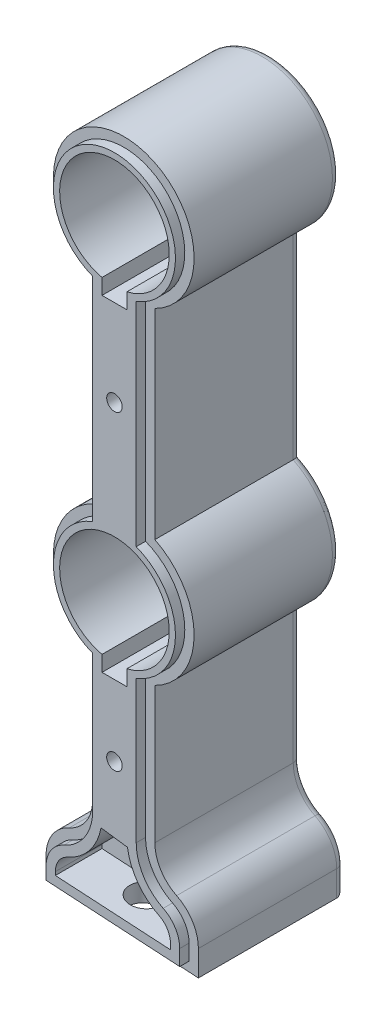
from build123d import *

# Parameters (mm, degrees)
SKETCH_15_R          = 9.05
SKETCH_15_R_2        = 6.25
EXTRUDE_4_DEPTH      = 20
EXTRUDE_4_2_DEPTH    = 20
SKETCH_16_W          = 8
SKETCH_16_H          = 25.763929046
EXTRUDE_4_3_DEPTH    = 20
EXTRUDE_5_DEPTH      = 20
FILLET_5_R           = 5
FILLET_6_R           = 5
FILLET_7_R           = 1
CUT_EXTRUDE_START    = -18.8
SKETCH_18_R          = 7.05
SKETCH_18_R_2        = 6.25
CUT_EXTRUDE_2_DEPTH  = 18.8
CUT_EXTRUDE_START_2  = -1.2
CUT_EXTRUDE_3_DEPTH  = 1.2
SKETCH_20_R          = 1
CUT_EXTRUDE_6_DEPTH  = 8
SKETCH_21_R          = 2.5
SKETCH_21_R_2        = 2
CUT_EXTRUDE_7_DEPTH  = 4
SKETCH_22_R          = 1.6
SKETCH_22_R_2        = 2
CUT_EXTRUDE_8_DEPTH  = 4
EXTRUDE_5_2_DEPTH    = 1
CUT_EXTRUDE_START_3  = -6
CUT_EXTRUDE_9_DEPTH  = 6
CUT_EXTRUDE_START_4  = -1
CUT_EXTRUDE_10_DEPTH = 1
SKETCH_26_W          = 3.2
SKETCH_26_H          = 2
CUT_EXTRUDE_11_DEPTH = 18.8


with BuildPart() as part:
    # Эскиз15 → Extrude 4 (new body)
    with BuildSketch(Plane.XY):
        with Locations((0, 21)):
            Circle(SKETCH_15_R)
        with Locations((0, 21)):
            Circle(SKETCH_15_R_2, mode=Mode.SUBTRACT)
    extrude(amount=EXTRUDE_4_DEPTH)



with BuildPart() as body_2:
    # Эскиз15 → Extrude 4 2 (new body)
    with BuildSketch(Plane.XY):
        with Locations((0, -21)):
            Circle(SKETCH_15_R)
        with Locations((0, -21)):
            Circle(SKETCH_15_R_2, mode=Mode.SUBTRACT)
    extrude(amount=EXTRUDE_4_2_DEPTH)


with BuildPart() as part_1:
    add(part.part)

    add(body_2.part)  # Extrude 4 3 merges body 2
    # Эскиз16 → Extrude 4 3 (add)
    with BuildSketch(Plane.XY.offset(20)):
        Polygon((-4, -29.118035477), (-4, -58.118035477), (4, -58.590520728), (4, -29.118035477), align=None)
        Rectangle(SKETCH_16_W, SKETCH_16_H)
    extrude(amount=-EXTRUDE_4_3_DEPTH)

    # Эскиз17 → Extrude 5 (add)
    with BuildSketch(Plane(origin=(0, 0, 0), x_dir=(-1, 0, 0), z_dir=(0, 0, -1))):
        Polygon((4, -58.118035477), (10, -57.763671538), (10, -49.763671538), (-9.6, -50.921260403), (-9.6, -58.921260403), (-4, -58.590520728), align=None)
    extrude(amount=-EXTRUDE_5_DEPTH)

    # Скругление5
    fillet_5_edges = [part_1.edges().sort_by_distance(p)[0] for p in [
        (9.6, -50.921260403, 10),
        (-10, -49.763671538, 10),
    ]]
    fillet(fillet_5_edges, radius=FILLET_5_R)

    # Скругление6
    fillet_6_edges = [part_1.edges().sort_by_distance(p)[0] for p in [
        (-4, -50.118035477, 10),
        (4, -50.590520728, 10),
    ]]
    fillet(fillet_6_edges, radius=FILLET_6_R)

    # Скругление7
    fillet_7_edges = [part_1.edges().sort_by_distance(p)[0] for p in [
        (8.842640687, -52.988918622, 0),
        (4, -37.886363841, 0),
        (-4.816699867, -48.641149029, 0),
        (4.757359313, -49.300443516, 0),
        (0, 30.05, 0),
        (-4, 0, 0),
        (4, 0, 0),
        (-6.25, -21, 0),
        (-9.05, -21, 0),
        (9.05, -21, 0),
        (-0.2, -58.342465971, 0),
        (-4, -37.510285859, 0),
        (-6.25, 21, 0),
        (-10, -56.415679585, 0),
        (9.6, -57.277965168, 0),
        (-9.183300133, -52.329074844, 0),
    ]]
    fillet(fillet_7_edges, radius=FILLET_7_R)

    # Эскиз18 → Вырез-Вытянуть-Тонкостенный2 (cut)
    # profile 1 of 2: a face of its own
    with BuildSketch(Plane.XY.offset(20).offset(CUT_EXTRUDE_START)):
        with Locations((0, -21)):
            Circle(SKETCH_18_R)
        with Locations((0, -21)):
            Circle(SKETCH_18_R_2, mode=Mode.SUBTRACT)
    # profile 2 of 2: a face of its own
    with BuildSketch(Plane.XY.offset(20).offset(CUT_EXTRUDE_START)):
        with Locations((0, 21)):
            Circle(SKETCH_18_R)
        with Locations((0, 21)):
            Circle(SKETCH_18_R_2, mode=Mode.SUBTRACT)
    extrude(amount=CUT_EXTRUDE_2_DEPTH, mode=Mode.SUBTRACT)

    # Эскиз19 → Вырез-Вытянуть-Тонкостенный3 (cut)
    with BuildSketch(Plane.XY.offset(20).offset(CUT_EXTRUDE_START_2)):
        with BuildLine():
            Line((-10, -55.067687632), (-10, -57.763671538))
            Line((-10, -57.763671538), (9.6, -58.921260403))
            Line((9.6, -58.921260403), (9.6, -55.634669933))
            ThreePointArc((9.6, -55.634669933), (8.842640687, -52.988918622), (6.8, -51.144681069))
            ThreePointArc((6.8, -51.144681069), (4.757359313, -49.300443516), (4, -46.654692205))
            Line((4, -46.654692205), (4, -29.118035477))
            ThreePointArc((4, -29.118035477), (9.05, -21), (4, -12.881964523))
            Line((4, -12.881964523), (4, 12.881964523))
            ThreePointArc((4, 12.881964523), (0, 30.05), (-4, 12.881964523))
            Line((-4, 12.881964523), (-4, -12.881964523))
            ThreePointArc((-4, -12.881964523), (-9.05, -21), (-4, -29.118035477))
            Line((-4, -29.118035477), (-4, -45.902536242))
            ThreePointArc((-4, -45.902536242), (-4.816699867, -48.641149029), (-7, -50.485111937))
            ThreePointArc((-7, -50.485111937), (-9.183300133, -52.329074844), (-10, -55.067687632))
        make_face()
        with BuildLine():
            Line((-8.8, -55.067687632), (-8.8, -56.632453251))
            Line((-8.8, -56.632453251), (8.4, -57.648296541))
            Line((8.4, -57.648296541), (8.4, -55.634669933))
            ThreePointArc((8.4, -55.634669933), (7.824406922, -53.623898937), (6.272, -52.222278396))
            ThreePointArc((6.272, -52.222278396), (3.739125548, -49.935423831), (2.8, -46.654692205))
            Line((2.8, -46.654692205), (2.8, -28.333655296))
            ThreePointArc((2.8, -28.333655296), (7.85, -21), (2.8, -13.666344704))
            Line((2.8, -13.666344704), (2.8, 13.666344704))
            ThreePointArc((2.8, 13.666344704), (0, 28.85), (-2.8, 13.666344704))
            Line((-2.8, 13.666344704), (-2.8, -13.666344704))
            ThreePointArc((-2.8, -13.666344704), (-7.85, -21), (-2.8, -28.333655296))
            Line((-2.8, -28.333655296), (-2.8, -45.902536242))
            ThreePointArc((-2.8, -45.902536242), (-3.812707835, -49.298416098), (-6.52, -51.584930104))
            ThreePointArc((-6.52, -51.584930104), (-8.179308101, -52.986341913), (-8.8, -55.067687632))
        make_face(mode=Mode.SUBTRACT)
    extrude(amount=CUT_EXTRUDE_3_DEPTH, mode=Mode.SUBTRACT)

    # Эскиз20 → Вырез-Вытянуть6 (cut)
    with BuildSketch(Plane.XY.offset(20)):
        with Locations((0, 1)):
            Circle(SKETCH_20_R)
        with Locations((0, -39)):
            Circle(SKETCH_20_R)
    extrude(amount=-CUT_EXTRUDE_6_DEPTH, mode=Mode.SUBTRACT)

    # Эскиз21 → Вырез-Вытянуть7 (cut)
    with BuildSketch(Plane(origin=(-3.434462011, -58.151436522, 0), x_dir=(0.998260468936824, -0.058957918535447094, 0), z_dir=(-0.05895791853544709, -0.9982604689368239, 0))):
        with Locations((3.242175373, 10)):
            Circle(SKETCH_21_R)
        with Locations((3.242175373, 16)):
            Circle(SKETCH_21_R_2)
    extrude(amount=-CUT_EXTRUDE_7_DEPTH, mode=Mode.SUBTRACT)

    # Эскиз22 → Вырез-Вытянуть8 (cut)
    with BuildSketch(Plane(origin=(-3.198630336, -54.158394646, 0), x_dir=(0.998260468936824, -0.058957918535447115, 0), z_dir=(-0.05895791853544711, -0.9982604689368239, 0))):
        with Locations((3.242175373, 10)):
            Circle(SKETCH_22_R)
        with Locations((3.242175373, 16)):
            Circle(SKETCH_22_R_2)
    extrude(amount=-CUT_EXTRUDE_8_DEPTH, mode=Mode.SUBTRACT)

    # Эскиз23 → Extrude 5 2 (add)
    with BuildSketch(Plane.XY.offset(20)):
        with BuildLine():
            ThreePointArc((-6.52, -51.584930104), (-8.179308101, -52.986341913), (-8.8, -55.067687632))
            Line((-8.8, -55.067687632), (-8.8, -56.632453251))
            Line((-8.8, -56.632453251), (8.4, -57.648296541))
            Line((8.4, -57.648296541), (8.4, -55.634669933))
            ThreePointArc((8.4, -55.634669933), (7.824406922, -53.623898937), (6.272, -52.222278396))
            ThreePointArc((6.272, -52.222278396), (3.739125548, -49.935423831), (2.8, -46.654692205))
            Line((2.8, -46.654692205), (-2.8, -45.902536242))
            ThreePointArc((-2.8, -45.902536242), (-3.812707835, -49.298416098), (-6.52, -51.584930104))
        make_face()
        with BuildLine():
            ThreePointArc((-6.04, -52.68474827), (-7.175316069, -53.643608982), (-7.6, -55.067687632))
            Line((-7.6, -55.067687632), (-7.6, -55.501234964))
            Line((-7.6, -55.501234964), (7.2, -56.375332679))
            Line((7.2, -56.375332679), (7.2, -55.634669933))
            ThreePointArc((7.2, -55.634669933), (6.806173157, -54.258879251), (5.744, -53.299875724))
            ThreePointArc((5.744, -53.299875724), (3.018230754, -51.011116965), (1.676290149, -47.714538428))
            Line((1.676290149, -47.714538428), (-1.725140216, -47.25768019))
            ThreePointArc((-1.725140216, -47.25768019), (-3.207646792, -50.507820632), (-6.04, -52.68474827))
        make_face(mode=Mode.SUBTRACT)
    extrude(amount=EXTRUDE_5_2_DEPTH)

    # Эскиз24 → Вырез-Вытянуть9 (cut)
    with BuildSketch(Plane.XY.offset(20).offset(CUT_EXTRUDE_START_3)):
        with BuildLine():
            Line((7.2, -56.375332679), (7.2, -55.634669933))
            ThreePointArc((7.2, -55.634669933), (6.806173157, -54.258879251), (5.744, -53.299875724))
            ThreePointArc((5.744, -53.299875724), (3.018230754, -51.011116965), (1.676290149, -47.714538428))
            Line((1.676290149, -47.714538428), (-1.725140216, -47.25768019))
            ThreePointArc((-1.725140216, -47.25768019), (-3.207646792, -50.507820632), (-6.04, -52.68474827))
            ThreePointArc((-6.04, -52.68474827), (-7.175316069, -53.643608982), (-7.6, -55.067687632))
            Line((-7.6, -55.067687632), (-7.6, -55.501234964))
            Line((-7.6, -55.501234964), (7.2, -56.375332679))
        make_face()
    extrude(amount=CUT_EXTRUDE_9_DEPTH, mode=Mode.SUBTRACT)

    # Эскиз25 → Вырез-Вытянуть10 (cut)
    with BuildSketch(Plane.XY.offset(21).offset(CUT_EXTRUDE_START_4)):
        with BuildLine():
            Line((2.8, -46.654692205), (-2.8, -45.902536242))
            ThreePointArc((-2.8, -45.902536242), (-3.812707835, -49.298416098), (-6.52, -51.584930104))
            ThreePointArc((-6.52, -51.584930104), (-8.179308101, -52.986341913), (-8.8, -55.067687632))
            Line((-8.8, -55.067687632), (-8.8, -56.632453251))
            Line((-8.8, -56.632453251), (8.4, -57.648296541))
            Line((8.4, -57.648296541), (8.4, -55.634669933))
            ThreePointArc((8.4, -55.634669933), (7.824406922, -53.623898937), (6.272, -52.222278396))
            ThreePointArc((6.272, -52.222278396), (3.739125548, -49.935423831), (2.8, -46.654692205))
        make_face()
    extrude(amount=CUT_EXTRUDE_10_DEPTH, mode=Mode.SUBTRACT)

    # Эскиз26 → Вырез-Вытянуть11 (cut)
    with BuildSketch(Plane.XY.offset(20)):
        with Locations((0, 13.133960385)):
            Rectangle(SKETCH_26_W, SKETCH_26_H)
        with Locations((0, -28.866039615)):
            Rectangle(SKETCH_26_W, SKETCH_26_H)
    extrude(amount=-CUT_EXTRUDE_11_DEPTH, mode=Mode.SUBTRACT)


solid = part_1.part
